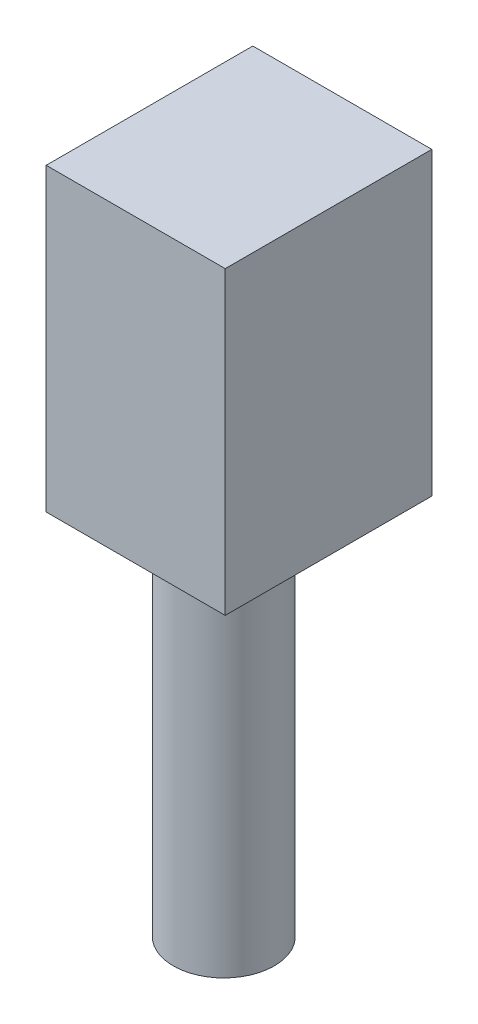
from build123d import *

# Parameters (mm, degrees)
SKETCH1_W      = 123.698
SKETCH1_H      = 142.748
EXTRUDE1_DEPTH = 207.518
SKETCH2_R      = 34.925
EXTRUDE2_DEPTH = 264.16


with BuildPart() as part:
    # Sketch1 → Extrude1 (new body)
    with BuildSketch(Plane(origin=(0, 0, 0), x_dir=(1, 0, 0), z_dir=(0, 1, 0))):
        with Locations((10.507234487, 23.665651739)):
            Rectangle(SKETCH1_W, SKETCH1_H)
    extrude(amount=EXTRUDE1_DEPTH)

    # Sketch2 → Extrude2 (add)
    with BuildSketch(Plane.XZ):
        with Locations(Location((0, -23.665651739, 0), (0, 0, 270))):
            Circle(SKETCH2_R)
    extrude(amount=EXTRUDE2_DEPTH)


solid = part.part
